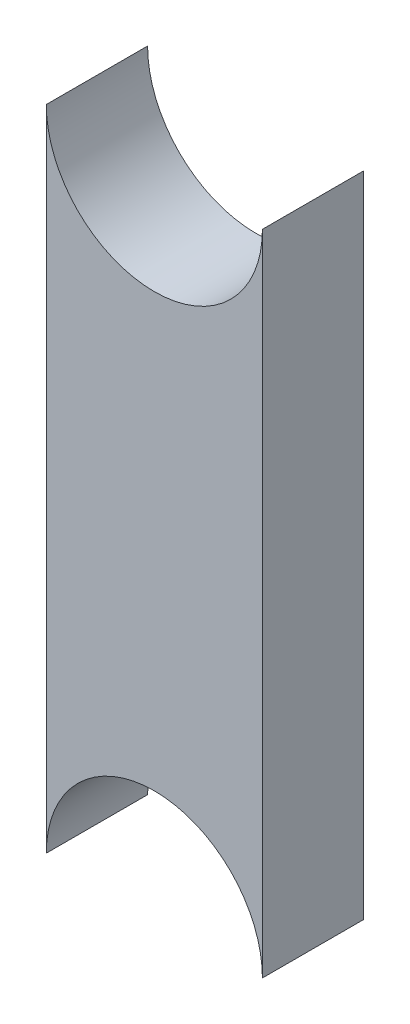
from build123d import *

# Parameters (mm, degrees)
BOSS_EXTRUDE3_DEPTH = 3


with BuildPart() as part:
    # Sketch1 → Boss-Extrude3 (new body)
    with BuildSketch(Plane.XY):
        with BuildLine():
            Line((-3.2, 0), (-3.2, 19.2))
            ThreePointArc((-3.2, 19.2), (0, 16), (3.2, 19.2))
            Line((3.2, 19.2), (3.2, 0))
            ThreePointArc((3.2, 0), (0, 3.2), (-3.2, 0))
        make_face()
    extrude(amount=BOSS_EXTRUDE3_DEPTH)


solid = part.part
